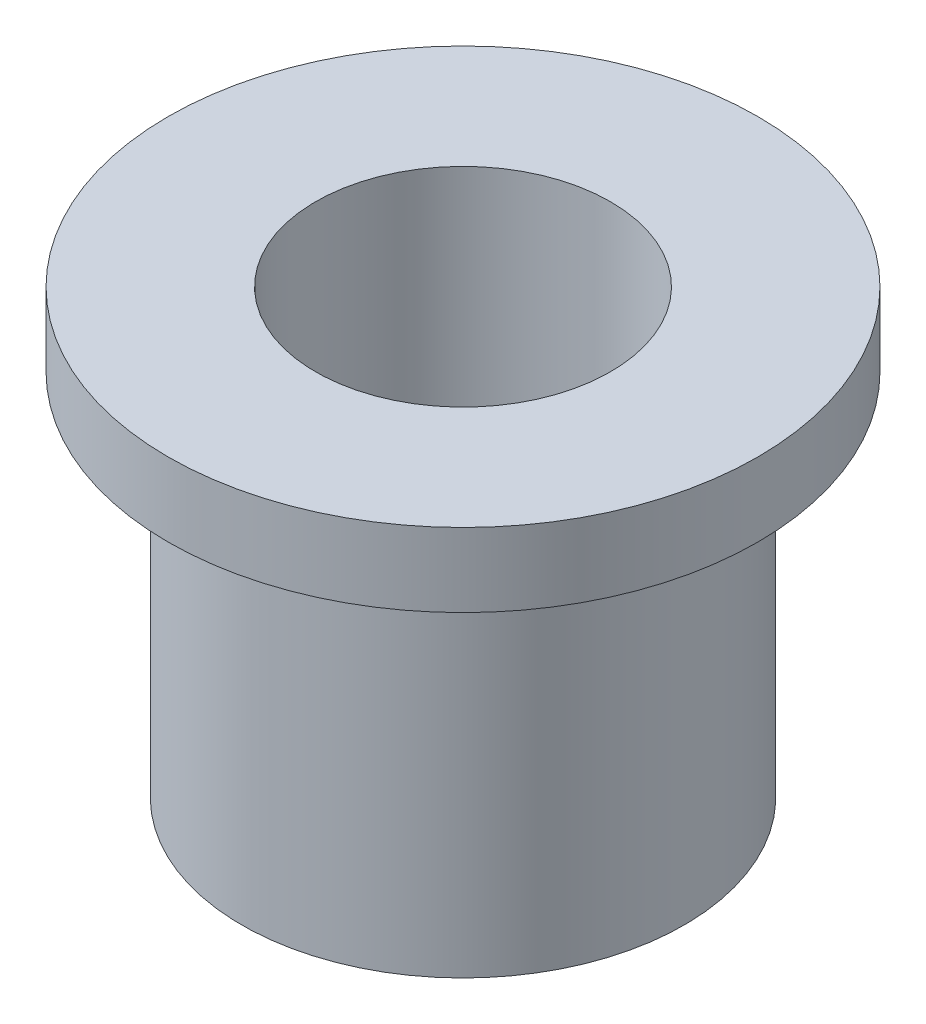
from build123d import *

# Parameters (mm, degrees)
SKETCH1_R           = 4.7625
SKETCH1_R_2         = 3.175
BOSS_EXTRUDE1_DEPTH = 9.525
BOSS_EXTRUDE2_START = -1.5875
SKETCH2_R           = 6.35
SKETCH2_R_2         = 3.175
BOSS_EXTRUDE2_DEPTH = 1.5875


with BuildPart() as part:
    # Sketch1 → Boss-Extrude1 (new body)
    with BuildSketch(Plane(origin=(0, 0, 0), x_dir=(1, 0, 0), z_dir=(0, 1, 0))):
        with Locations(Location((0, 0, 0), (0, 0, 90))):
            Circle(SKETCH1_R)
        with Locations(Location((0, 0, 0), (0, 0, 90))):
            Circle(SKETCH1_R_2, mode=Mode.SUBTRACT)
    extrude(amount=BOSS_EXTRUDE1_DEPTH)

    # Sketch2 → Boss-Extrude2 (add)
    with BuildSketch(Plane(origin=(0, 9.525, 0), x_dir=(1, 0, 0), z_dir=(0, 1, 0)).offset(BOSS_EXTRUDE2_START)):
        with Locations(Location((0, 0, 0), (0, 0, 270))):
            Circle(SKETCH2_R)
        with Locations(Location((0, 0, 0), (0, 0, 90))):
            Circle(SKETCH2_R_2, mode=Mode.SUBTRACT)
    extrude(amount=BOSS_EXTRUDE2_DEPTH)


solid = part.part
